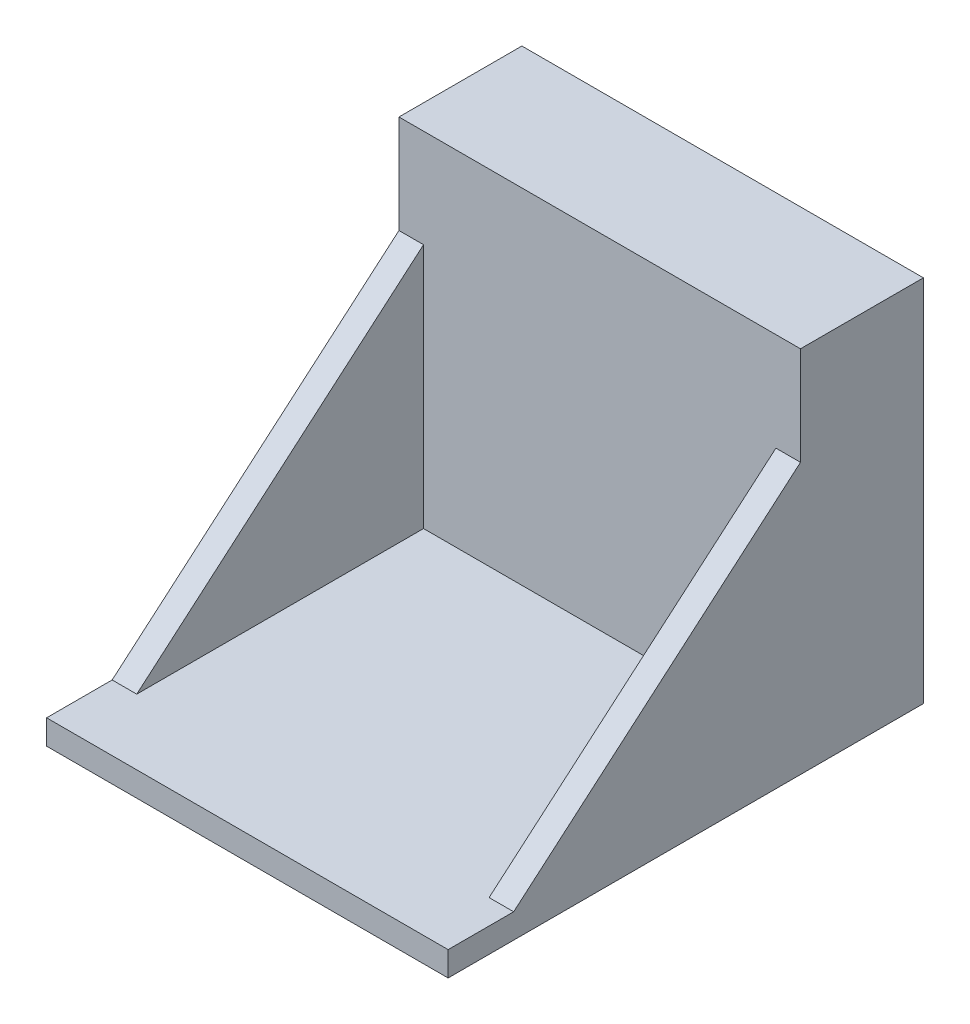
from build123d import *

# Parameters (mm, degrees)
SKETCH1_W           = 49
SKETCH1_H           = 45
BOSS_EXTRUDE1_DEPTH = 15
SKETCH2_W           = 49
SKETCH2_H           = 3
BOSS_EXTRUDE2_DEPTH = 43
BOSS_EXTRUDE3_DEPTH = 3
BOSS_EXTRUDE4_DEPTH = 3


with BuildPart() as part:
    # Sketch1 → Boss-Extrude1 (new body)
    with BuildSketch(Plane.XY):
        with Locations((-2.402173913, 0.366847826)):
            Rectangle(SKETCH1_W, SKETCH1_H)
    extrude(amount=BOSS_EXTRUDE1_DEPTH)

    # Sketch2 → Boss-Extrude2 (add)
    with BuildSketch(Plane.XY.offset(15)):
        with Locations((-2.402173913, -20.633152174)):
            Rectangle(SKETCH2_W, SKETCH2_H)
    extrude(amount=BOSS_EXTRUDE2_DEPTH)

    # Sketch4 → Boss-Extrude3 (add)
    with BuildSketch(Plane.ZY.offset(26.902173913)):
        Polygon((15, -19.133152174), (15, 10.866847826), (50, -19.133152174), align=None)
    extrude(amount=-BOSS_EXTRUDE3_DEPTH)

    # Sketch5 → Boss-Extrude4 (add)
    with BuildSketch(Plane(origin=(22.097826087, 0, 0), x_dir=(0, 0, -1), z_dir=(1, 0, 0))):
        Polygon((-15, -19.133152174), (-15, 10.866847826), (-50, -19.133152174), align=None)
    extrude(amount=-BOSS_EXTRUDE4_DEPTH)


solid = part.part
